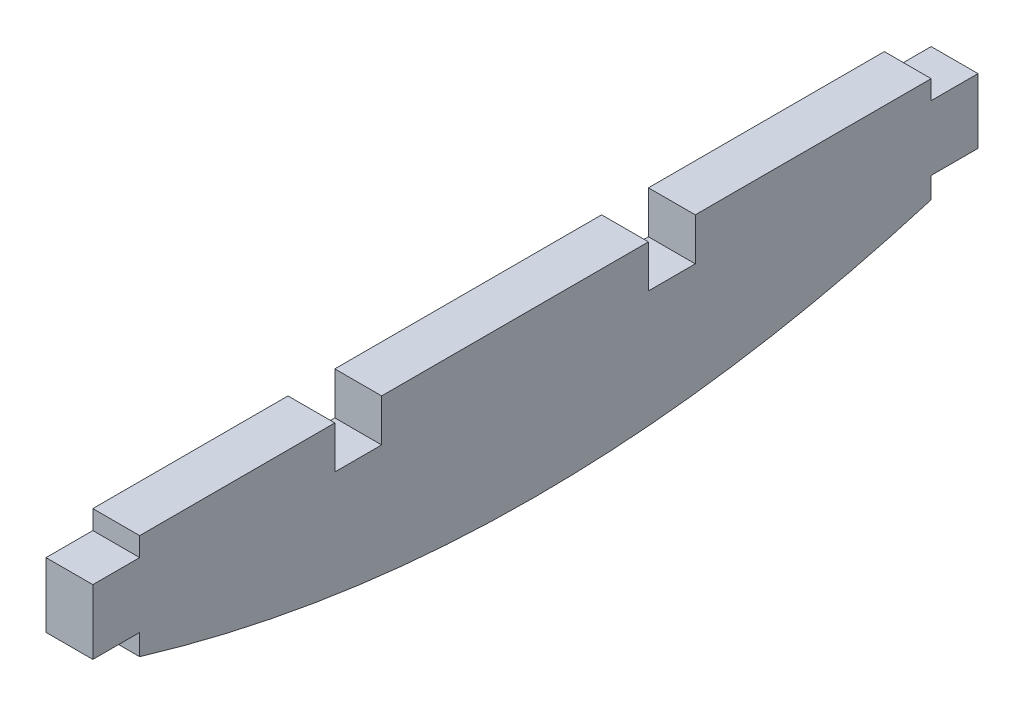
from build123d import *

# Parameters (mm, degrees)
SKICA3_W                 = 50.7
SKICA3_H                 = 6.72
P_IDAT_VYSUNUT_M1_DEPTH  = 3
SKICA3_3_W               = 3
SKICA3_3_H               = 4.15
P_IDAT_VYSUNUT_M2_DEPTH  = 3
SKICA3_4_W               = 3
SKICA3_4_H               = 4.15
P_IDAT_VYSUNUT_M3_DEPTH  = 3
P_IDAT_VYSUNUT_M4_DEPTH  = 3
SKICA5_W                 = 3
SKICA5_H                 = 5.420631859
ODEBRAT_VYSUNUT_M1_DEPTH = 3


with BuildPart() as part:
    # Skica3 → Přidat vysunutím1 (new body)
    with BuildSketch(Plane(origin=(0, 0, 0), x_dir=(0, 0, -1), z_dir=(1, 0, 0))):
        with Locations((9.501921455, -0.065)):
            Rectangle(SKICA3_W, SKICA3_H)
    extrude(amount=P_IDAT_VYSUNUT_M1_DEPTH)

    # Skica3<3> → Přidat vysunutím2 (add)
    with BuildSketch(Plane(origin=(0, 0, 0), x_dir=(0, 0, -1), z_dir=(1, 0, 0))):
        with Locations((36.351921455, 0)):
            Rectangle(SKICA3_3_W, SKICA3_3_H)
    extrude(amount=P_IDAT_VYSUNUT_M2_DEPTH)

    # Skica3<4> → Přidat vysunutím3 (add)
    with BuildSketch(Plane(origin=(0, 0, 0), x_dir=(0, 0, -1), z_dir=(1, 0, 0))):
        with Locations((-17.348078545, 0)):
            Rectangle(SKICA3_4_W, SKICA3_4_H)
    extrude(amount=P_IDAT_VYSUNUT_M3_DEPTH)

    # Skica3<6> → Přidat vysunutím4 (add)
    with BuildSketch(Plane(origin=(0, 0, 0), x_dir=(0, 0, -1), z_dir=(1, 0, 0))):
        with BuildLine():
            Line((34.851921455, -3.425), (-15.848078545, -3.425))
            add(Edge.make_bspline(
                [(34.851921455, -3.425), (9.501921455, -11.026061801), (-15.848078545, -3.425)],
                knots=[0, 0, 0, 1, 1, 1], degree=2))
        make_face()
    extrude(amount=P_IDAT_VYSUNUT_M4_DEPTH)

    # Skica5 → Odebrat vysunutím1 (cut)
    with BuildSketch(Plane(origin=(3, 0, 0), x_dir=(0, 0, -1), z_dir=(1, 0, 0))):
        with Locations((-1.848078545, 3.28531593)):
            Rectangle(SKICA5_W, SKICA5_H)
        with Locations((18.241921455, 3.28531593)):
            Rectangle(SKICA5_W, SKICA5_H)
    extrude(amount=-ODEBRAT_VYSUNUT_M1_DEPTH, mode=Mode.SUBTRACT)


solid = part.part
